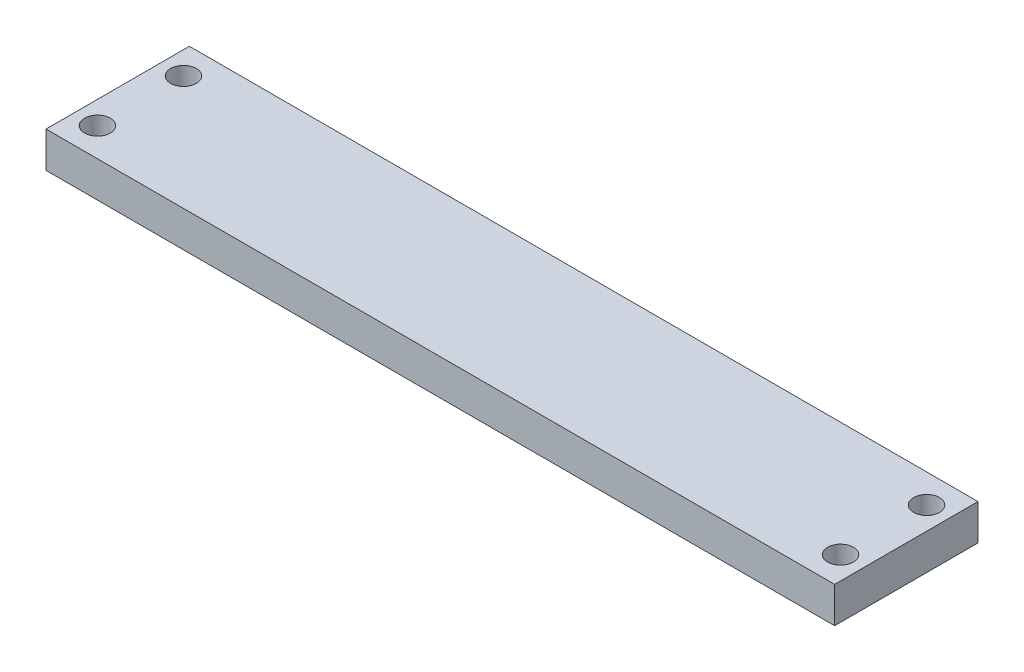
from build123d import *

# Parameters (mm, degrees)
SKETCH1_W            = 110
SKETCH1_H            = 20
BOSS_EXTRUDE1_DEPTH  = 2.5
M3_CLEARANCE_HOLE1_D = 3.6


with BuildPart() as part:
    # Sketch1 → Boss-Extrude1 (new, symmetric)
    with BuildSketch(Plane(origin=(0, 0, 0), x_dir=(1, 0, 0), z_dir=(0, 1, 0))):
        Rectangle(SKETCH1_W, SKETCH1_H)
    extrude(amount=BOSS_EXTRUDE1_DEPTH, both=True)

    # M3 Clearance Hole1 (through all)
    with Locations(Plane(origin=(0, 2.5, 0), x_dir=(1, 0, 0), z_dir=(0, 1, 0))):
        with Locations((51.825, 6), (-51.825, -6), (51.825, -6), (-51.825, 6)):
            Hole(M3_CLEARANCE_HOLE1_D / 2)


solid = part.part
